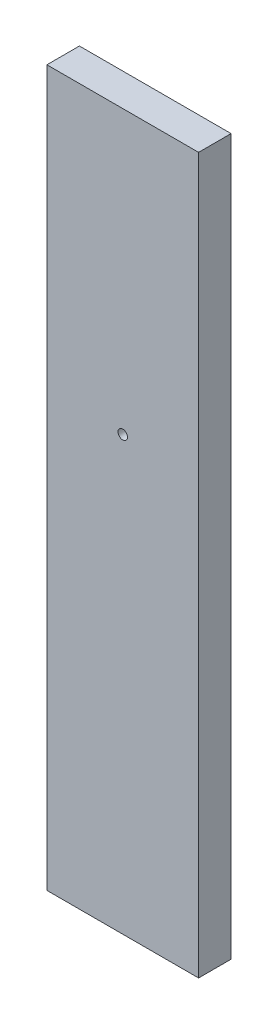
from build123d import *

# Parameters (mm, degrees)
SKETCH1_W           = 88.9
SKETCH1_H           = 19.05
BOSS_EXTRUDE1_DEPTH = 419.1
SKETCH2_R           = 2.778125
CUT_EXTRUDE1_DEPTH  = 429.848367725


with BuildPart() as part:
    # Sketch1 → Boss-Extrude1 (new body)
    with BuildSketch(Plane(origin=(0, 0, 0), x_dir=(1, 0, 0), z_dir=(0, 1, 0))):
        with Locations((44.45, 9.525)):
            Rectangle(SKETCH1_W, SKETCH1_H)
    extrude(amount=BOSS_EXTRUDE1_DEPTH)

    # Sketch2 → Cut-Extrude1 (cut, through all)
    with BuildSketch(Plane.XY):
        with Locations((44.45, 253.651766)):
            Circle(SKETCH2_R)
    extrude(amount=-CUT_EXTRUDE1_DEPTH, mode=Mode.SUBTRACT)


solid = part.part
